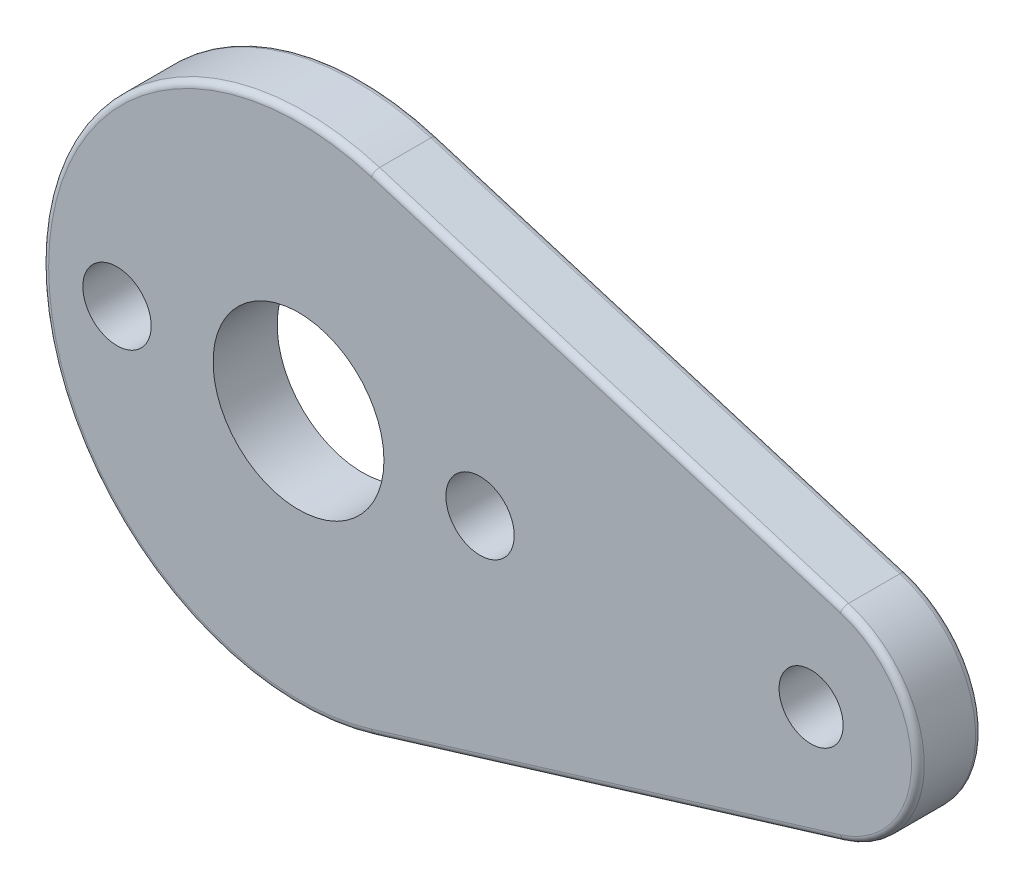
from build123d import *

# Parameters (mm, degrees)
ESQUISSE1_R        = 4
ESQUISSE1_R_2      = 1.5
ESQUISSE1_R_3      = 1.6
BOSS_EXTRU_1_DEPTH = 3
CONG_2_R           = 0.3


with BuildPart() as part:
    # Esquisse1 → Boss.-Extru.1 (new body)
    with BuildSketch(Plane.XY):
        with BuildLine():
            Line((3.5, 11.478240283), (25.458333333, 4.782600118))
            ThreePointArc((25.458333333, 4.782600118), (29, 0), (25.458333333, -4.782600118))
            Line((25.458333333, -4.782600118), (3.5, -11.478240283))
            ThreePointArc((3.5, -11.478240283), (-12, 0), (3.5, 11.478240283))
        make_face()
        Circle(ESQUISSE1_R, mode=Mode.SUBTRACT)
        with Locations((24, 0)):
            Circle(ESQUISSE1_R_2, mode=Mode.SUBTRACT)
        with Locations((-8.5, 0)):
            Circle(ESQUISSE1_R_3, mode=Mode.SUBTRACT)
        with Locations(Location((8.5, 0, 0), (0, 0, 180))):
            Circle(ESQUISSE1_R_3, mode=Mode.SUBTRACT)
    extrude(amount=BOSS_EXTRU_1_DEPTH)

    # Congé2
    cong_2_edges = [part.edges().sort_by_distance(p)[0] for p in [
        (29, 0, 3),
        (14.479166667, 8.130420201, 3),
        (-12, 0, 3),
        (14.479166667, 8.130420201, 0),
        (29, 0, 0),
        (14.479166667, -8.130420201, 0),
        (-12, 0, 0),
        (14.479166667, -8.130420201, 3),
    ]]
    fillet(cong_2_edges, radius=CONG_2_R)


solid = part.part
